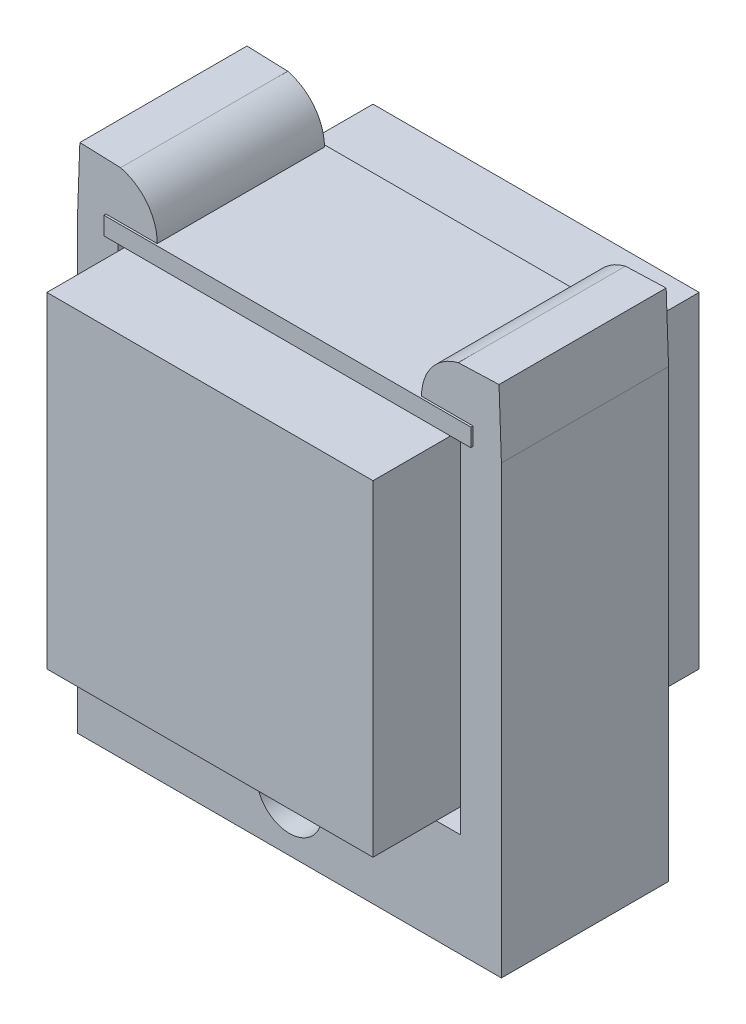
from build123d import *

# Parameters (mm, degrees)
SKETCH1_W                            = 45
SKETCH1_H                            = 21
BOSS_EXTRUDE1_DEPTH                  = 2.2
SKETCH2_W                            = 40
SKETCH2_H                            = 40
BOSS_EXTRUDE2_DEPTH                  = 40
SKETCH3_W                            = 42
SKETCH3_H                            = 12.7
SKETCH3_R                            = 4
SNAPFIT_42MM_SPACING_5MM_WIDTH_DEPTH = 10.25


with BuildPart() as part:
    # Sketch1 → Boss-Extrude1 (new body)
    with BuildSketch(Plane(origin=(0, 0, 0), x_dir=(1, 0, 0), z_dir=(0, 1, 0))):
        Rectangle(SKETCH1_W, SKETCH1_H)
    extrude(amount=BOSS_EXTRUDE1_DEPTH)


with BuildPart() as body_2:
    # Sketch2 → Boss-Extrude2 (new body)
    with BuildSketch(Plane(origin=(0, 0, 0), x_dir=(1, 0, 0), z_dir=(0, 1, 0))):
        Rectangle(SKETCH2_W, SKETCH2_H)
    extrude(amount=-BOSS_EXTRUDE2_DEPTH)


with BuildPart() as body_3:
    # Sketch3 → SnapFit-42mm_spacing-5mm_width (new, symmetric)
    # profile 1 of 3: a face of its own
    with BuildSketch(Plane.XY):
        with Locations((0, -48.35)):
            Rectangle(SKETCH3_W, SKETCH3_H)
        with Locations((0, -48.35)):
            Circle(SKETCH3_R, mode=Mode.SUBTRACT)
    # profile 2 of 3: a face of its own
    with BuildSketch(Plane.XY):
        with BuildLine():
            Line((-26, -54.7), (-21, -54.7))
            Line((-21, -54.7), (-21, -42))
            Line((-21, -42), (-21, 0))
            Line((-21, 0), (-20.921478633, 2.19859828))
            Line((-20.921478633, 2.19859828), (-16.210515178, 2.030349585))
            ThreePointArc((-16.210515178, 2.030349585), (-17.401240008, 5.819652348), (-20.710515178, 8.016317753))
            Line((-20.710515178, 8.016317753), (-25.70732945, 8.194775406))
            Line((-25.70732945, 8.194775406), (-26, 0))
            Line((-26, 0), (-26, -54.7))
        make_face()
    # profile 3 of 3: a face of its own
    with BuildSketch(Plane.XY):
        with BuildLine():
            Line((21, -42), (21, -54.7))
            Line((21, -54.7), (26, -54.7))
            Line((26, -54.7), (26, 0))
            Line((26, 0), (25.70732945, 8.194775406))
            Line((25.70732945, 8.194775406), (20.710515178, 8.016317753))
            ThreePointArc((20.710515178, 8.016317753), (17.401240008, 5.819652348), (16.210515178, 2.030349585))
            Line((16.210515178, 2.030349585), (20.921478633, 2.19859828))
            Line((20.921478633, 2.19859828), (21, 0))
            Line((21, 0), (21, -42))
        make_face()
    extrude(amount=SNAPFIT_42MM_SPACING_5MM_WIDTH_DEPTH, both=True)


solid = Compound([part.part, body_2.part, body_3.part])
